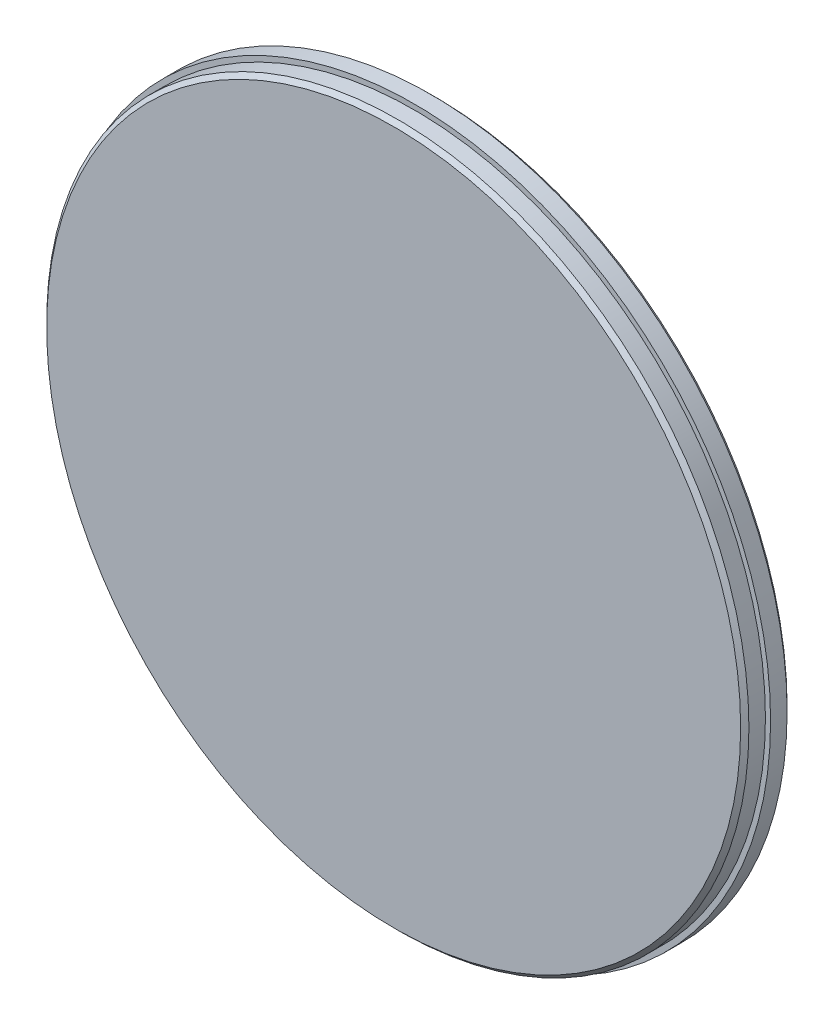
from build123d import *

# Parameters (mm, degrees)
SKETCH1_R           = 17.25
SKETCH1_R_2         = 17
BOSS_EXTRUDE1_DEPTH = 1
SKETCH1_2_R         = 17
BOSS_EXTRUDE2_DEPTH = 2
CHAMFER1_SIZE       = 0.2


with BuildPart() as part:
    # Sketch1 → Boss-Extrude1 (new body)
    with BuildSketch(Plane.XY):
        Circle(SKETCH1_R)
        Circle(SKETCH1_R_2, mode=Mode.SUBTRACT)
    extrude(amount=BOSS_EXTRUDE1_DEPTH)

    # Sketch1<2> → Boss-Extrude2 (add)
    with BuildSketch(Plane.XY):
        Circle(SKETCH1_2_R)
    extrude(amount=BOSS_EXTRUDE2_DEPTH)

    # Chamfer1
    chamfer1_edges = [part.edges().sort_by_distance(p)[0] for p in [
        (-17.25, 0, 0),
        (-17, 0, 2),
    ]]
    chamfer(chamfer1_edges, length=CHAMFER1_SIZE)


solid = part.part
